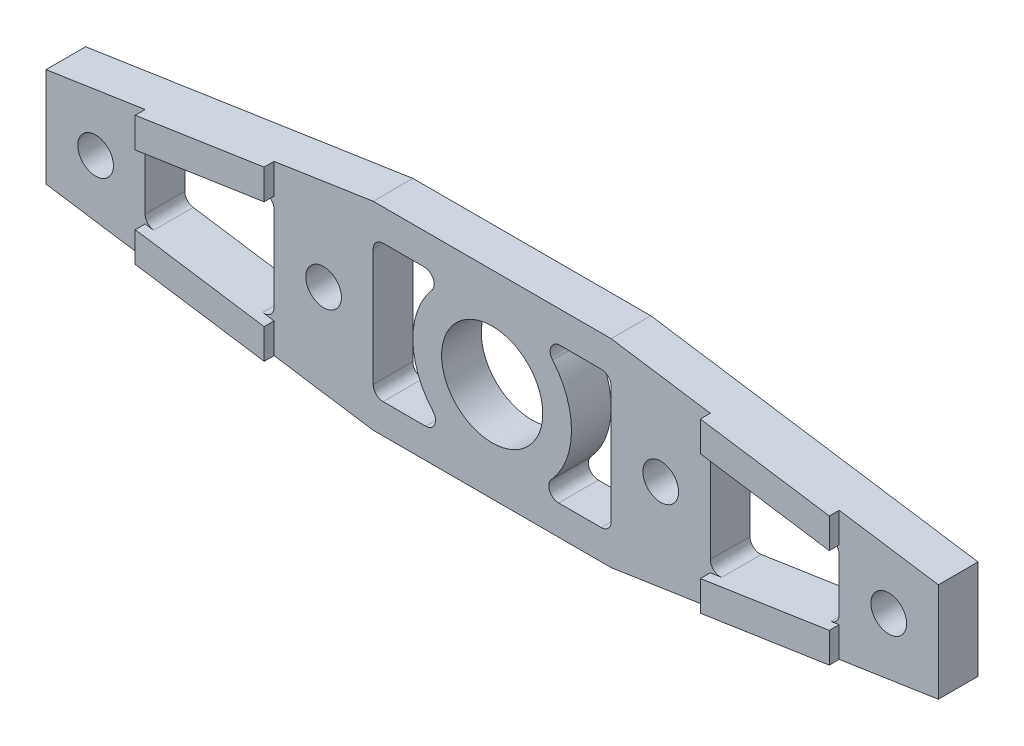
from build123d import *

# Parameters (mm, degrees)
SKETCH_1_W          = 90
SKETCH_1_H          = 20
EXTRUDE_1_DEPTH     = 4
SKETCH_2_W          = 13
SKETCH_2_H          = 20
EXTRUDE_2_DEPTH     = 1
SKETCH_4_R          = 5.1
EXTRUDE_3_DEPTH     = 4
SKETCH_3_R          = 1.8
CUT_EXTRUDE_1_DEPTH = 47.270941205
SKETCH_4_3_R        = 5.1
CUT_EXTRUDE_3_DEPTH = 47.270941205
SKETCH_7_OUTSIDE_W  = 110.466
SKETCH_7_OUTSIDE_H  = 40.466
CUT_EXTRUDE_6_DEPTH = 10
CUT_EXTRUDE_7_DEPTH = 47.368092477
CUT_EXTRUDE_8_DEPTH = 47.270941205
FILLET_1_R          = 1


with BuildPart() as part:
    # ｽｹｯﾁ1 → ﾎﾞｽ - 押し出し1 (new body)
    with BuildSketch(Plane.XY):
        Rectangle(SKETCH_1_W, SKETCH_1_H)
    extrude(amount=EXTRUDE_1_DEPTH)

    # ｽｹｯﾁ2 → ﾎﾞｽ - 押し出し2 (add)
    with BuildSketch(Plane.XY.offset(4)):
        with Locations((-28.5, 0)):
            Rectangle(SKETCH_2_W, SKETCH_2_H)
        with Locations((28.5, 0)):
            Rectangle(SKETCH_2_W, SKETCH_2_H)
    extrude(amount=EXTRUDE_2_DEPTH)

    # ｽｹｯﾁ4 → ﾎﾞｽ - 押し出し3 (add)
    with BuildSketch(Plane.XY.offset(4)):
        Circle(SKETCH_4_R)
    extrude(amount=-EXTRUDE_3_DEPTH)

    # ｽｹｯﾁ3 → ｶｯﾄ - 押し出し1 (cut, through all)
    with BuildSketch(Plane.XY.offset(4)):
        with Locations((-40, 0)):
            Circle(SKETCH_3_R)
        with Locations((-17, 0)):
            Circle(SKETCH_3_R)
        with Locations((17, 0)):
            Circle(SKETCH_3_R)
        with Locations((40, 0)):
            Circle(SKETCH_3_R)
    extrude(amount=-CUT_EXTRUDE_1_DEPTH, mode=Mode.SUBTRACT)

    # ｽｹｯﾁ4<3> → ｶｯﾄ - 押し出し3 (cut, through all)
    with BuildSketch(Plane.XY.offset(4)):
        Circle(SKETCH_4_3_R)
    extrude(amount=-CUT_EXTRUDE_3_DEPTH, mode=Mode.SUBTRACT)

    # ｽｹｯﾁ7 outside → ｶｯﾄ - 押し出し6 (cut)
    with BuildSketch(Plane(origin=(0, 0, 0), x_dir=(-1, 0, 0), z_dir=(0, 0, -1))):
        Rectangle(SKETCH_7_OUTSIDE_W, SKETCH_7_OUTSIDE_H)
        Polygon((-45, 5), (-45, -5), (-12, -10), (12, -10), (45, -5), (45, 5), (12, 10), (-12, 10), align=None, mode=Mode.SUBTRACT)
    extrude(amount=-CUT_EXTRUDE_6_DEPTH, mode=Mode.SUBTRACT)

    # ｽｹｯﾁ8 → ｶｯﾄ - 押し出し7 (cut, through all)
    with BuildSketch(Plane.XY.offset(5)):
        Polygon((22, 5.450608618), (22, -5.450608618), (35, -3.480911648), (35, 3.480911648), align=None)
        Polygon((-22, 5.450608618), (-35, 3.480911648), (-35, -3.480911648), (-22, -5.450608618), align=None)
    extrude(amount=-CUT_EXTRUDE_7_DEPTH, mode=Mode.SUBTRACT)

    # ｽｹｯﾁ9 → ｶｯﾄ - 押し出し8 (cut, through all)
    with BuildSketch(Plane.XY.offset(4)):
        with BuildLine():
            Line((-12, 6.837276926), (-12, -7))
            Line((-12, -7), (-3.872983346, -7))
            ThreePointArc((-3.872983346, -7), (-7.998356489, -0.162152651), (-4.153509869, 6.837276926))
            Line((-4.153509869, 6.837276926), (-12, 6.837276926))
        make_face()
        with BuildLine():
            Line((4.153509869, 6.837276926), (12, 6.837276926))
            Line((12, 6.837276926), (12, -7))
            Line((12, -7), (3.872983346, -7))
            ThreePointArc((3.872983346, -7), (7.998356489, -0.162152651), (4.153509869, 6.837276926))
        make_face()
    extrude(amount=-CUT_EXTRUDE_8_DEPTH, mode=Mode.SUBTRACT)

    # ﾌｨﾚｯﾄ1
    fillet_1_edges = [part.edges().sort_by_distance(p)[0] for p in [
        (22, 5.450608618, 2),
        (35, 3.480911648, 2),
        (35, -3.480911648, 2),
        (22, -5.450608618, 2),
        (-22, 5.450608618, 2),
        (-22, -5.450608618, 2),
        (-35, -3.480911648, 2),
        (-35, 3.480911648, 2),
        (-12, 6.837276926, 2),
        (-4.153509869, 6.837276926, 2),
        (-3.872983346, -7, 2),
        (-12, -7, 2),
        (12, -7, 2),
        (3.872983346, -7, 2),
        (4.153509869, 6.837276926, 2),
        (12, 6.837276926, 2),
    ]]
    fillet(fillet_1_edges, radius=FILLET_1_R)


solid = part.part
